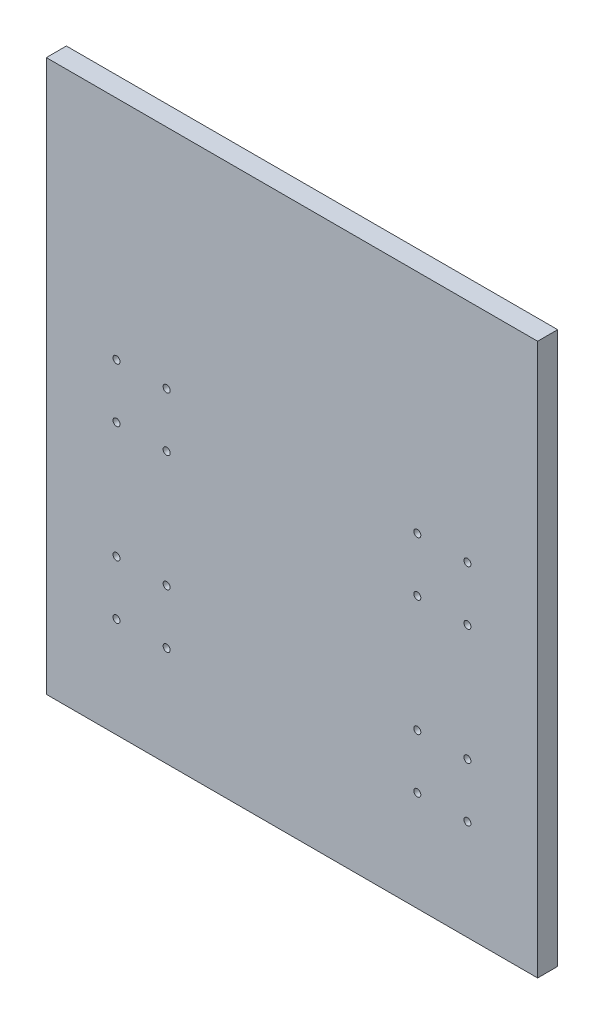
from build123d import *

# Parameters (mm, degrees)
SKETCH_1_W      = 490
SKETCH_1_H      = 550
SKETCH_1_R      = 3.5
EXTRUDE_1_DEPTH = 20


with BuildPart() as part:
    # Эскиз1 → Бобышка-Вытянуть1 (new body)
    with BuildSketch(Plane.XY):
        Rectangle(SKETCH_1_W, SKETCH_1_H)
        with Locations((-175, -175)):
            Circle(SKETCH_1_R, mode=Mode.SUBTRACT)
        with Locations((-125, -175)):
            Circle(SKETCH_1_R, mode=Mode.SUBTRACT)
        with Locations((-175, -121)):
            Circle(SKETCH_1_R, mode=Mode.SUBTRACT)
        with Locations((-125, -121)):
            Circle(SKETCH_1_R, mode=Mode.SUBTRACT)
        with Locations((-175, -5)):
            Circle(SKETCH_1_R, mode=Mode.SUBTRACT)
        with Locations((-125, -5)):
            Circle(SKETCH_1_R, mode=Mode.SUBTRACT)
        with Locations((125, -175)):
            Circle(SKETCH_1_R, mode=Mode.SUBTRACT)
        with Locations((175, -175)):
            Circle(SKETCH_1_R, mode=Mode.SUBTRACT)
        with Locations((125, -121)):
            Circle(SKETCH_1_R, mode=Mode.SUBTRACT)
        with Locations((175, -121)):
            Circle(SKETCH_1_R, mode=Mode.SUBTRACT)
        with Locations((125, -5)):
            Circle(SKETCH_1_R, mode=Mode.SUBTRACT)
        with Locations((175, -5)):
            Circle(SKETCH_1_R, mode=Mode.SUBTRACT)
        with Locations((-175, 49)):
            Circle(SKETCH_1_R, mode=Mode.SUBTRACT)
        with Locations((-125, 49)):
            Circle(SKETCH_1_R, mode=Mode.SUBTRACT)
        with Locations((125, 49)):
            Circle(SKETCH_1_R, mode=Mode.SUBTRACT)
        with Locations((175, 49)):
            Circle(SKETCH_1_R, mode=Mode.SUBTRACT)
    extrude(amount=EXTRUDE_1_DEPTH)


solid = part.part
